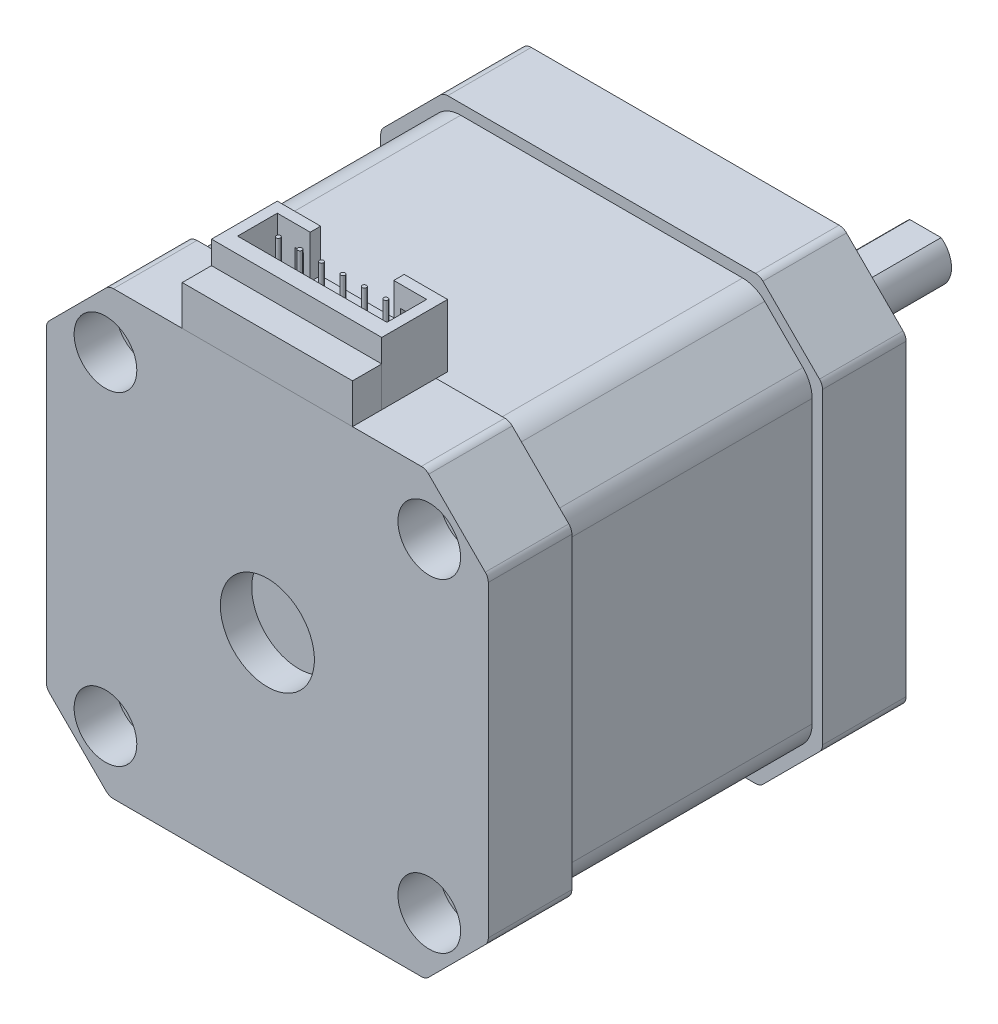
from build123d import *

# Parameters (mm, degrees)
SKETCH1_W            = 42.3
SKETCH1_H            = 42.3
BOSS_EXTRUDE1_DEPTH  = 8
CHAMFER1_SIZE        = 6
FILLET1_R            = 1
BOSS_EXTRUDE4_DEPTH  = 24
FILLET2_R            = 3
BOSS_EXTRUDE5_DEPTH  = 8
SKETCH7_R            = 1.5
CUT_EXTRUDE1_DEPTH   = 50.946421293
SKETCH8_R            = 4.5
CUT_EXTRUDE2_DEPTH   = 50.946421293
BOSS_EXTRUDE7_START  = 1.8
SKETCH9_R            = 11
SKETCH9_R_2          = 4.5
BOSS_EXTRUDE7_DEPTH  = 1.8
FILLET4_R            = 0.5
FILLET5_R            = 0.2
SKETCH12_R           = 4.5
BOSS_EXTRUDE8_DEPTH  = 10
SKETCH16_R           = 2.5
BOSS_EXTRUDE9_DEPTH  = 50
CUT_EXTRUDE10_DEPTH  = 20
SKETCH24_W           = 16.3
SKETCH24_H           = 3.8
BOSS_EXTRUDE17_DEPTH = 2.8
SKETCH25_W           = 16.3
SKETCH25_H           = 6
BOSS_EXTRUDE18_DEPTH = 6.3
SKETCH26_W           = 8
SKETCH26_H           = 4.1
CUT_EXTRUDE6_DEPTH   = 4
SKETCH28_W           = 14.3
SKETCH28_H           = 3.8
CUT_EXTRUDE7_DEPTH   = 5
CUT_EXTRUDE8_DEPTH   = 1
SKETCH29_R           = 0.2
BOSS_EXTRUDE19_DEPTH = 5
SKETCH30_R           = 3
SKETCH30_R_2         = 1.5
CUT_EXTRUDE9_DEPTH   = 4


with BuildPart() as part:
    # Sketch1 → Boss-Extrude1 (new body)
    with BuildSketch(Plane.XY):
        Rectangle(SKETCH1_W, SKETCH1_H)
    extrude(amount=BOSS_EXTRUDE1_DEPTH)

    # Chamfer1
    chamfer1_edges = [part.edges().sort_by_distance(p)[0] for p in [
        (-21.15, -21.15, 4),
        (21.15, -21.15, 4),
        (21.15, 21.15, 4),
        (-21.15, 21.15, 4),
    ]]
    chamfer(chamfer1_edges, length=CHAMFER1_SIZE)

    # Fillet1
    fillet1_edges = [part.edges().sort_by_distance(p)[0] for p in [
        (-15.15, 21.15, 4),
        (-21.15, 15.15, 4),
        (-21.15, -15.15, 4),
        (-15.15, -21.15, 4),
        (15.15, -21.15, 4),
        (21.15, -15.15, 4),
        (21.15, 15.15, 4),
        (15.15, 21.15, 4),
    ]]
    fillet(fillet1_edges, radius=FILLET1_R)


with BuildPart() as body_2:
    # Sketch3 → Boss-Extrude4 (new body)
    with BuildSketch(Plane(origin=(0, 0, 0), x_dir=(-1, 0, 0), z_dir=(0, 0, -1))):
        Polygon((-14.735786438, 20.15), (14.735786438, 20.15), (20.15, 14.735786438), (20.15, -14.735786438), (14.735786438, -20.15), (-14.735786438, -20.15), (-20.15, -14.735786438), (-20.15, 14.735786438), align=None)
    extrude(amount=BOSS_EXTRUDE4_DEPTH)

    # Fillet2
    fillet2_edges = [body_2.edges().sort_by_distance(p)[0] for p in [
        (20.15, -14.735786438, -12),
        (14.735786438, -20.15, -12),
        (-14.735786438, -20.15, -12),
        (-20.15, -14.735786438, -12),
        (-20.15, 14.735786438, -12),
        (-14.735786438, 20.15, -12),
        (20.15, 14.735786438, -12),
        (14.735786438, 20.15, -12),
    ]]
    fillet(fillet2_edges, radius=FILLET2_R)


with BuildPart() as body_3:
    # Sketch6 → Boss-Extrude5 (new body)
    with BuildSketch(Plane(origin=(0, 0, -24), x_dir=(-1, 0, 0), z_dir=(0, 0, -1))):
        with BuildLine():
            Line((15.442893219, -20.857106781), (20.857106781, -15.442893219))
            ThreePointArc((20.857106781, -15.442893219), (21.073879533, -15.11846987), (21.15, -14.735786438))
            Line((21.15, -14.735786438), (21.15, 14.735786438))
            ThreePointArc((21.15, 14.735786438), (21.073879533, 15.11846987), (20.857106781, 15.442893219))
            Line((20.857106781, 15.442893219), (15.442893219, 20.857106781))
            ThreePointArc((15.442893219, 20.857106781), (15.11846987, 21.073879533), (14.735786438, 21.15))
            Line((14.735786438, 21.15), (-14.735786438, 21.15))
            ThreePointArc((-14.735786438, 21.15), (-15.11846987, 21.073879533), (-15.442893219, 20.857106781))
            Line((-15.442893219, 20.857106781), (-20.857106781, 15.442893219))
            ThreePointArc((-20.857106781, 15.442893219), (-21.073879533, 15.11846987), (-21.15, 14.735786438))
            Line((-21.15, 14.735786438), (-21.15, -14.735786438))
            ThreePointArc((-21.15, -14.735786438), (-21.073879533, -15.11846987), (-20.857106781, -15.442893219))
            Line((-20.857106781, -15.442893219), (-15.442893219, -20.857106781))
            ThreePointArc((-15.442893219, -20.857106781), (-15.11846987, -21.073879533), (-14.735786438, -21.15))
            Line((-14.735786438, -21.15), (14.735786438, -21.15))
            ThreePointArc((14.735786438, -21.15), (15.11846987, -21.073879533), (15.442893219, -20.857106781))
        make_face()
    extrude(amount=BOSS_EXTRUDE5_DEPTH)


with BuildPart() as cut_extrude1_tool:
    # Sketch7 → Cut-Extrude1 (new, through all)
    with BuildSketch(Plane.XY.offset(8)):
        with Locations((-15.5, 15.5)):
            Circle(SKETCH7_R)
        with Locations((15.5, 15.5)):
            Circle(SKETCH7_R)
        with Locations((15.5, -15.5)):
            Circle(SKETCH7_R)
        with Locations((-15.5, -15.5)):
            Circle(SKETCH7_R)
    extrude(amount=-CUT_EXTRUDE1_DEPTH)


with BuildPart() as part_1:
    add(part.part)

    # Cut-Extrude1: cut by cut_extrude1_tool
    add(cut_extrude1_tool.part, mode=Mode.SUBTRACT)


with BuildPart() as body_2_1:
    add(body_2.part)

    # Cut-Extrude1: cut by cut_extrude1_tool
    add(cut_extrude1_tool.part, mode=Mode.SUBTRACT)


with BuildPart() as body_3_1:
    add(body_3.part)

    # Cut-Extrude1: cut by cut_extrude1_tool
    add(cut_extrude1_tool.part, mode=Mode.SUBTRACT)


with BuildPart() as cut_extrude2_tool:
    # Sketch8 → Cut-Extrude2 (new, through all)
    with BuildSketch(Plane(origin=(0, 0, -32), x_dir=(-1, 0, 0), z_dir=(0, 0, -1))):
        Circle(SKETCH8_R)
    extrude(amount=-CUT_EXTRUDE2_DEPTH)


with BuildPart() as part_2:
    add(part_1.part)

    # Cut-Extrude2: cut by cut_extrude2_tool
    add(cut_extrude2_tool.part, mode=Mode.SUBTRACT)

    # Sketch30 → Cut-Extrude9 (cut)
    # profile 1 of 4: a face of its own
    with BuildSketch(Plane.XY.offset(8)):
        with Locations((-15.5, 15.5)):
            Circle(SKETCH30_R)
        with Locations((-15.5, 15.5)):
            Circle(SKETCH30_R_2, mode=Mode.SUBTRACT)
    # profile 2 of 4: a face of its own
    with BuildSketch(Plane.XY.offset(8)):
        with Locations((15.5, 15.5)):
            Circle(SKETCH30_R)
        with Locations((15.5, 15.5)):
            Circle(SKETCH30_R_2, mode=Mode.SUBTRACT)
    # profile 3 of 4: a face of its own
    with BuildSketch(Plane.XY.offset(8)):
        with Locations((15.5, -15.5)):
            Circle(SKETCH30_R)
        with Locations((15.5, -15.5)):
            Circle(SKETCH30_R_2, mode=Mode.SUBTRACT)
    # profile 4 of 4: a face of its own
    with BuildSketch(Plane.XY.offset(8)):
        with Locations((-15.5, -15.5)):
            Circle(SKETCH30_R)
        with Locations((-15.5, -15.5)):
            Circle(SKETCH30_R_2, mode=Mode.SUBTRACT)
    extrude(amount=-CUT_EXTRUDE9_DEPTH, mode=Mode.SUBTRACT)


with BuildPart() as body_2_2:
    add(body_2_1.part)

    # Cut-Extrude2: cut by cut_extrude2_tool
    add(cut_extrude2_tool.part, mode=Mode.SUBTRACT)



with BuildPart() as body_3_2:
    add(body_3_1.part)

    # Cut-Extrude2: cut by cut_extrude2_tool
    add(cut_extrude2_tool.part, mode=Mode.SUBTRACT)

    # Sketch9 → Boss-Extrude7 (add)
    with BuildSketch(Plane(origin=(0, 0, -32), x_dir=(-1, 0, 0), z_dir=(0, 0, -1)).offset(BOSS_EXTRUDE7_START)):
        Circle(SKETCH9_R)
        Circle(SKETCH9_R_2, mode=Mode.SUBTRACT)
    extrude(amount=-BOSS_EXTRUDE7_DEPTH)

    # Fillet4
    fillet4_edges = [body_3_2.edges().sort_by_distance(p)[0] for p in [
        (11, 0, -32),
    ]]
    fillet(fillet4_edges, radius=FILLET4_R)

    # Fillet5
    fillet5_edges = [body_3_2.edges().sort_by_distance(p)[0] for p in [
        (11, 0, -33.8),
    ]]
    fillet(fillet5_edges, radius=FILLET5_R)


with BuildPart() as body_4:
    # Sketch12 → Boss-Extrude8 (new body)
    with BuildSketch(Plane.XY.offset(5)):
        Circle(SKETCH12_R)
    extrude(amount=-BOSS_EXTRUDE8_DEPTH)


with BuildPart() as body_2_3:
    add(body_2_2.part)

    add(body_3_2.part)  # Boss-Extrude9 merges body 3

    add(body_4.part)  # Boss-Extrude9 merges body 4
    # Sketch16 → Boss-Extrude9 (add)
    with BuildSketch(Plane(origin=(0, 0, -5), x_dir=(-1, 0, 0), z_dir=(0, 0, -1))):
        Circle(SKETCH16_R)
    extrude(amount=BOSS_EXTRUDE9_DEPTH)

    # Sketch17 → Cut-Extrude10 (cut)
    with BuildSketch(Plane(origin=(0, 0, -55), x_dir=(-1, 0, 0), z_dir=(0, 0, -1))):
        with BuildLine():
            Line((-1.5, 2), (1.5, 2))
            ThreePointArc((1.5, 2), (0, 2.5), (-1.5, 2))
        make_face()
    extrude(amount=-CUT_EXTRUDE10_DEPTH, mode=Mode.SUBTRACT)


with BuildPart() as body_3_2_1:
    # Sketch24 → Boss-Extrude17 (new body)
    with BuildSketch(Plane.XY.offset(8)):
        with Locations((0, 23.05)):
            Rectangle(SKETCH24_W, SKETCH24_H)
    extrude(amount=-BOSS_EXTRUDE17_DEPTH)


with BuildPart() as body_4_2:
    # Sketch25 → Boss-Extrude18 (new body)
    with BuildSketch(Plane(origin=(0, 0, 5.2), x_dir=(-1, 0, 0), z_dir=(0, 0, -1))):
        with Locations((0, 24.15)):
            Rectangle(SKETCH25_W, SKETCH25_H)
    extrude(amount=BOSS_EXTRUDE18_DEPTH)

    # Sketch26 → Cut-Extrude6 (cut)
    with BuildSketch(Plane(origin=(0, 0, -1.1), x_dir=(-1, 0, 0), z_dir=(0, 0, -1))):
        with Locations((0, 25.1)):
            Rectangle(SKETCH26_W, SKETCH26_H)
    extrude(amount=-CUT_EXTRUDE6_DEPTH, mode=Mode.SUBTRACT)

    # Sketch28 → Cut-Extrude7 (cut)
    with BuildSketch(Plane(origin=(0, 27.15, 0), x_dir=(1, 0, 0), z_dir=(0, 1, 0))):
        with Locations((0, -1.8)):
            Rectangle(SKETCH28_W, SKETCH28_H)
    extrude(amount=-CUT_EXTRUDE7_DEPTH, mode=Mode.SUBTRACT)

    # Sketch26<4> → Cut-Extrude8 (cut)
    with BuildSketch(Plane(origin=(0, 0, -1.1), x_dir=(-1, 0, 0), z_dir=(0, 0, -1))):
        Polygon((-5.45, 25.15), (-5.45, 21.15), (5.45, 21.15), (5.45, 25.15), (4.65, 25.15), (4.65, 21.65), (-4.65, 21.65), (-4.65, 25.15), align=None)
    extrude(amount=-CUT_EXTRUDE8_DEPTH, mode=Mode.SUBTRACT)

    # Sketch29 → Boss-Extrude19 (add)
    with BuildSketch(Plane(origin=(0, 22.15, 0), x_dir=(1, 0, 0), z_dir=(0, 1, 0))):
        with Locations((-5.147005039, -1.8)):
            Circle(SKETCH29_R)
        with Locations((-3.088203024, -1.8)):
            Circle(SKETCH29_R)
        with Locations((-1.029401008, -1.8)):
            Circle(SKETCH29_R)
        with Locations((1.029401008, -1.8)):
            Circle(SKETCH29_R)
        with Locations((3.088203024, -1.8)):
            Circle(SKETCH29_R)
        with Locations((5.147005039, -1.8)):
            Circle(SKETCH29_R)
    extrude(amount=BOSS_EXTRUDE19_DEPTH)


solid = Compound([part_2.part, body_2_3.part, body_3_2_1.part, body_4_2.part])
